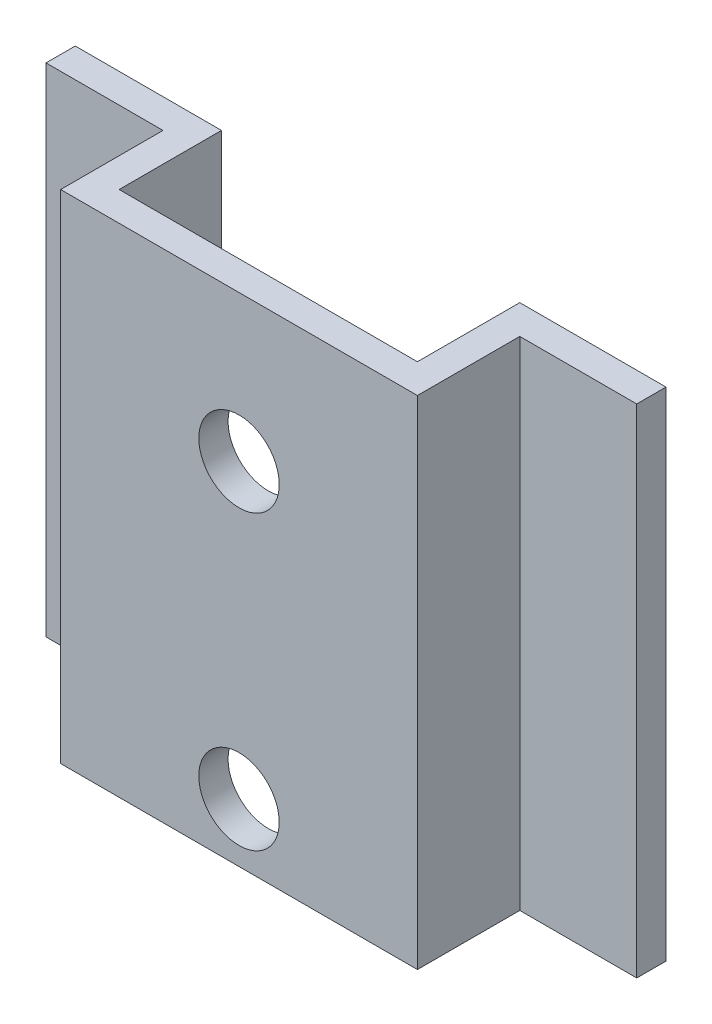
from build123d import *

# Parameters (mm, degrees)
SKETCH1_W             = 20
SKETCH1_H             = 34
SKETCH1_R             = 2.75
BOSS_EXTRUDE1_DEPTH   = 2
SKETCH2_W             = 10
SKETCH2_H             = 34
BOSS_EXTRUDE2_DEPTH   = 2
BOSS_EXTRUDE2_2_DEPTH = 2
SKETCH3_W             = 10
SKETCH3_H             = 34
BOSS_EXTRUDE3_DEPTH   = 7
SKETCH4_W             = 20.4
SKETCH4_H             = 2
BOSS_EXTRUDE4_DEPTH   = 34
CUT_EXTRUDE2_DEPTH    = 41.162669234
SKETCH6_R             = 2.75
CUT_EXTRUDE3_DEPTH    = 66.582314689


with BuildPart() as part:
    # Sketch1 → Boss-Extrude1 (new body)
    with BuildSketch(Plane.XY):
        with Locations((0, 45)):
            Rectangle(SKETCH1_W, SKETCH1_H)
        with Locations((0, 32)):
            Circle(SKETCH1_R, mode=Mode.SUBTRACT)
        with Locations((0, 52)):
            Circle(SKETCH1_R, mode=Mode.SUBTRACT)
    extrude(amount=BOSS_EXTRUDE1_DEPTH)



with BuildPart() as body_2:
    # Sketch2 → Boss-Extrude2 (new body)
    with BuildSketch(Plane(origin=(0, 0, 0), x_dir=(-1, 0, 0), z_dir=(0, 0, -1))):
        with Locations((15.2, 45)):
            Rectangle(SKETCH2_W, SKETCH2_H)
    extrude(amount=-BOSS_EXTRUDE2_DEPTH)



with BuildPart() as body_3:
    # Sketch2 → Boss-Extrude2 2 (new body)
    with BuildSketch(Plane(origin=(0, 0, 0), x_dir=(-1, 0, 0), z_dir=(0, 0, -1))):
        with Locations((-15.2, 45)):
            Rectangle(SKETCH2_W, SKETCH2_H)
    extrude(amount=-BOSS_EXTRUDE2_2_DEPTH)


with BuildPart() as body_2_1:
    add(body_2.part)

    add(body_3.part)  # Boss-Extrude3 merges body 3
    # Sketch3 → Boss-Extrude3 (add)
    with BuildSketch(Plane(origin=(0, 0, 0), x_dir=(-1, 0, 0), z_dir=(0, 0, -1))):
        with Locations((-15.2, 45)):
            Rectangle(SKETCH3_W, SKETCH3_H)
        with Locations((15.2, 45)):
            Rectangle(SKETCH3_W, SKETCH3_H)
    extrude(amount=BOSS_EXTRUDE3_DEPTH)


with BuildPart() as part_1:
    add(part.part)

    add(body_2_1.part)  # Boss-Extrude4 merges body 2
    # Sketch4 → Boss-Extrude4 (add)
    with BuildSketch(Plane(origin=(0, 62, 0), x_dir=(1, 0, 0), z_dir=(0, 1, 0))):
        with Locations((0, -1)):
            Rectangle(SKETCH4_W, SKETCH4_H)
    extrude(amount=-BOSS_EXTRUDE4_DEPTH)

    # Sketch5 → Cut-Extrude2 (cut, through all)
    with BuildSketch(Plane(origin=(0, 62, 0), x_dir=(1, 0, 0), z_dir=(0, 1, 0))):
        Polygon((12.2, 0), (12.2, -2), (20.2, -2), (20.2, 5), (12.2, 5), align=None)
        Polygon((-12.2, -2), (-12.2, 0), (-12.2, 5), (-20.2, 5), (-20.2, -2), align=None)
    extrude(amount=-CUT_EXTRUDE2_DEPTH, mode=Mode.SUBTRACT)

    # Sketch6 → Cut-Extrude3 (cut, through all)
    with BuildSketch(Plane(origin=(0, 0, 0), x_dir=(-1, 0, 0), z_dir=(0, 0, -1))):
        with Locations((0, 52)):
            Circle(SKETCH6_R)
        with Locations((0, 32)):
            Circle(SKETCH6_R)
    extrude(amount=-CUT_EXTRUDE3_DEPTH, mode=Mode.SUBTRACT)


solid = part_1.part
